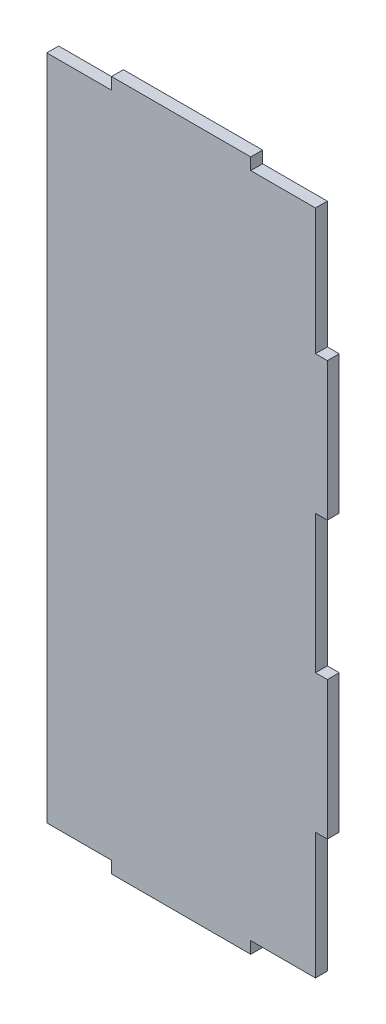
from build123d import *

# Parameters (mm, degrees)
SALIENTE_EXTRUIR1_DEPTH = 5.5


with BuildPart() as part:
    # Croquis1 → Saliente-Extruir1 (new body)
    with BuildSketch(Plane.XY):
        Polygon((45.426994895, 366.820828604), (75.426994895, 366.820828604), (75.426994895, 308.320828604), (80.926994895, 308.320828604), (80.926994895, 244.320828604), (75.426994895, 244.320828604), (75.426994895, 180.320828604), (80.926994895, 180.320828604), (80.926994895, 116.320828604), (75.426994895, 116.320828604), (75.426994895, 57.820828604), (45.426994895, 57.820828604), (45.426994895, 52.320828604), (-19.073005105, 52.320828604), (-19.073005105, 57.820828604), (-49.073005105, 57.820828604), (-49.073005105, 366.820828604), (-19.073005105, 366.820828604), (-19.073005105, 372.320828604), (45.426994895, 372.320828604), align=None)
    extrude(amount=SALIENTE_EXTRUIR1_DEPTH)


solid = part.part
